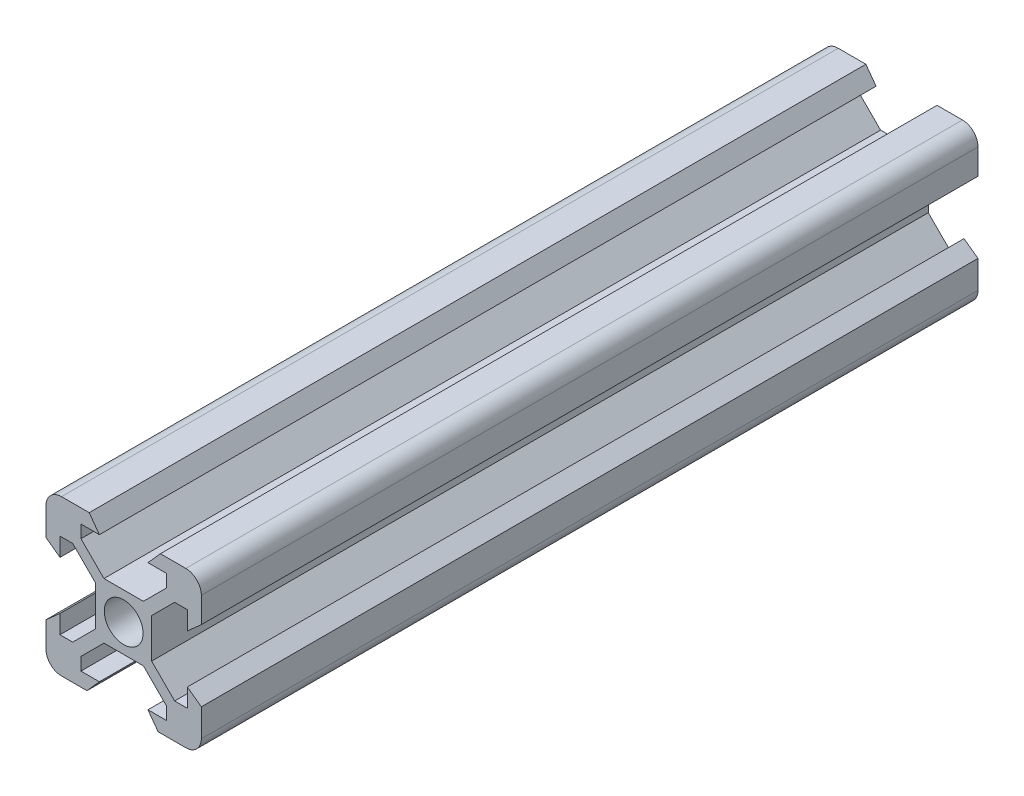
from build123d import *

# Parameters (mm, degrees)
SKETCH1_R           = 2.5
BOSS_EXTRUDE1_DEPTH = 100


with BuildPart() as part:
    # Sketch1 → Boss-Extrude1 (new body)
    with BuildSketch(Plane.XY):
        with BuildLine():
            Line((-4.725542729, -10), (-3.125, -8.2))
            Line((-3.125, -8.2), (-5.5, -8.2))
            Line((-5.5, -8.2), (-5.5, -6.560660172))
            Line((-5.5, -6.560660172), (-2.539339828, -3.6))
            Line((-2.539339828, -3.6), (2.539339828, -3.6))
            Line((2.539339828, -3.6), (5.5, -6.560660172))
            Line((5.5, -6.560660172), (5.5, -8.2))
            Line((5.5, -8.2), (3.125, -8.2))
            Line((3.125, -8.2), (4.434457271, -10))
            Line((4.434457271, -10), (8, -10))
            ThreePointArc((8, -10), (9.414213562, -9.414213562), (10, -8))
            Line((10, -8), (10, -4.434457271))
            Line((10, -4.434457271), (8.2, -3.125))
            Line((8.2, -3.125), (8.2, -5.5))
            Line((8.2, -5.5), (6.560660172, -5.5))
            Line((6.560660172, -5.5), (3.6, -2.539339828))
            Line((3.6, -2.539339828), (3.6, 2.539339828))
            Line((3.6, 2.539339828), (6.560660172, 5.5))
            Line((6.560660172, 5.5), (8.2, 5.5))
            Line((8.2, 5.5), (8.2, 3.125))
            Line((8.2, 3.125), (10, 4.725542729))
            Line((10, 4.725542729), (10, 8))
            ThreePointArc((10, 8), (9.414213562, 9.414213562), (8, 10))
            Line((8, 10), (4.725542729, 10))
            Line((4.725542729, 10), (3.125, 8.2))
            Line((3.125, 8.2), (5.5, 8.2))
            Line((5.5, 8.2), (5.5, 6.560660172))
            Line((5.5, 6.560660172), (2.539339828, 3.6))
            Line((2.539339828, 3.6), (-2.539339828, 3.6))
            Line((-2.539339828, 3.6), (-5.5, 6.560660172))
            Line((-5.5, 6.560660172), (-5.5, 8.2))
            Line((-5.5, 8.2), (-3.125, 8.2))
            Line((-3.125, 8.2), (-4.434457271, 10))
            Line((-4.434457271, 10), (-8, 10))
            ThreePointArc((-8, 10), (-9.414213562, 9.414213562), (-10, 8))
            Line((-10, 8), (-10, 4.434457271))
            Line((-10, 4.434457271), (-8.2, 3.125))
            Line((-8.2, 3.125), (-8.2, 5.5))
            Line((-8.2, 5.5), (-6.560660172, 5.5))
            Line((-6.560660172, 5.5), (-3.6, 2.539339828))
            Line((-3.6, 2.539339828), (-3.6, -2.539339828))
            Line((-3.6, -2.539339828), (-6.560660172, -5.5))
            Line((-6.560660172, -5.5), (-8.2, -5.5))
            Line((-8.2, -5.5), (-8.2, -3.125))
            Line((-8.2, -3.125), (-10, -4.725542729))
            Line((-10, -4.725542729), (-10, -8))
            ThreePointArc((-10, -8), (-9.414213562, -9.414213562), (-8, -10))
            Line((-8, -10), (-4.725542729, -10))
        make_face()
        Circle(SKETCH1_R, mode=Mode.SUBTRACT)
    extrude(amount=BOSS_EXTRUDE1_DEPTH)


solid = part.part
